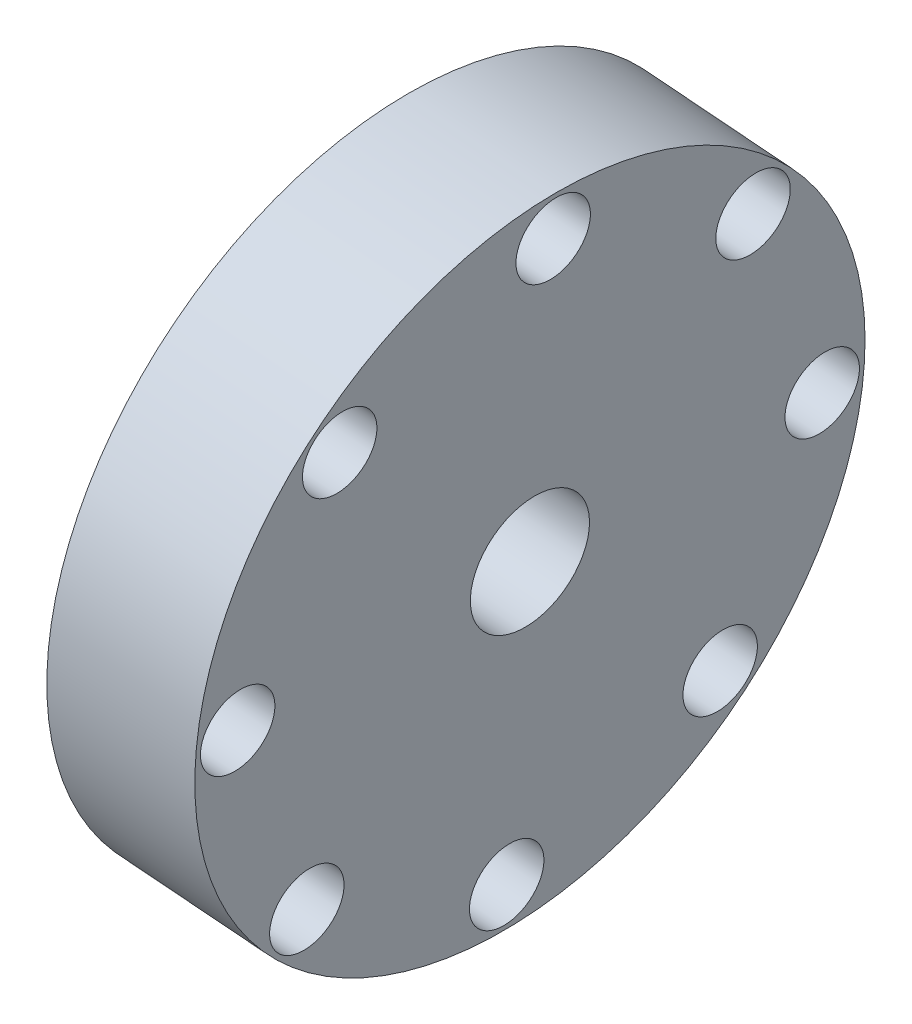
from build123d import *

# Parameters (mm, degrees)
SKETCH1_R           = 14.2875
BOSS_EXTRUDE1_DEPTH = 6.35
SKETCH2_R           = 2.54
CUT_EXTRUDE1_DEPTH  = 5.08
SKETCH3_R           = 1.5875
CUT_EXTRUDE2_DEPTH  = 10


with BuildPart() as part:
    # Sketch1 → Boss-Extrude1 (new body)
    with BuildSketch(Plane(origin=(234.278878836, -18.689027227, 0), x_dir=(0, 0, -1), z_dir=(0.9968332748770866, -0.0795199477981641, 0))):
        with Locations(Location((-43.174261814, 8.550344032, 0), (0, 0, 90))):
            Circle(SKETCH1_R)
    extrude(amount=-BOSS_EXTRUDE1_DEPTH)

    # Sketch2 → Cut-Extrude1 (cut)
    with BuildSketch(Plane(origin=(234.278878836, -18.689027227, 0), x_dir=(0, 0, -1), z_dir=(0.9968332748770866, -0.07951994779816411, 0))):
        with Locations(Location((-43.174261814, 8.550344032, 0), (0, 0, 90))):
            Circle(SKETCH2_R)
    extrude(amount=-CUT_EXTRUDE1_DEPTH, mode=Mode.SUBTRACT)

    # Sketch3 → Cut-Extrude2 (cut)
    with BuildSketch(Plane(origin=(227.94898754, -18.184075559, 0), x_dir=(0, 0, 1), z_dir=(-0.9968332748770866, 0.07951994779816411, 0))):
        with Locations(Location((30.674261814, 8.550344032, 0), (0, 0, 270))):
            Circle(SKETCH3_R)
        with Locations(Location((43.174261814, 21.050344032, 0), (0, 0, 270))):
            Circle(SKETCH3_R)
        with Locations(Location((52.013096579, 17.389178797, 0), (0, 0, 270))):
            Circle(SKETCH3_R)
        with Locations(Location((55.674261814, 8.550344032, 0), (0, 0, 270))):
            Circle(SKETCH3_R)
        with Locations(Location((52.013096579, -0.288490733, 0), (0, 0, 270))):
            Circle(SKETCH3_R)
        with Locations(Location((43.174261814, -3.949655968, 0), (0, 0, 270))):
            Circle(SKETCH3_R)
        with Locations(Location((34.33542705, -0.288490733, 0), (0, 0, 270))):
            Circle(SKETCH3_R)
        with Locations(Location((34.33542705, 17.389178797, 0), (0, 0, 270))):
            Circle(SKETCH3_R)
    extrude(amount=-CUT_EXTRUDE2_DEPTH, mode=Mode.SUBTRACT)


solid = part.part
